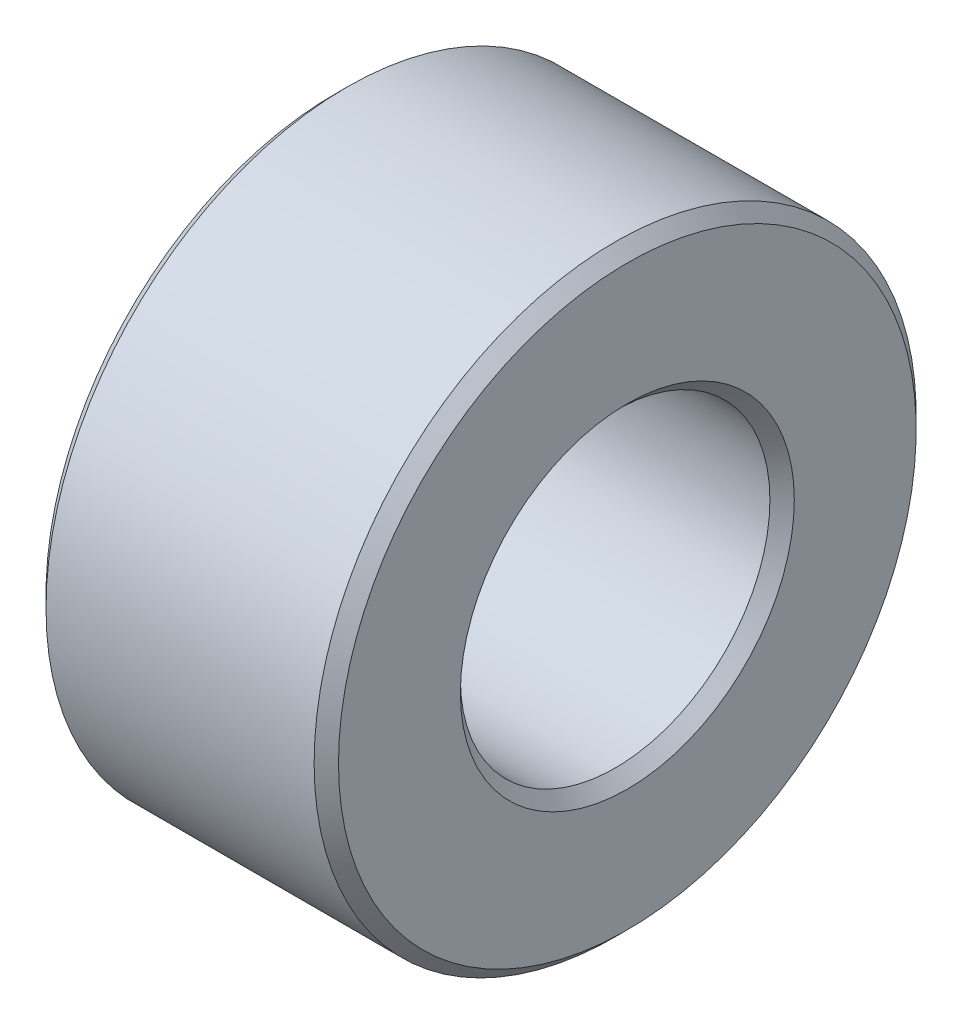
from build123d import *

# Parameters (mm, degrees)
SKETCH1_W     = 6
SKETCH1_H     = 3
CHAMFER1_SIZE = 0.25


with BuildPart() as part:
    # Sketch1 → Revolve1 (revolve)
    with BuildSketch(Plane.XY, mode=Mode.PRIVATE) as revolve1_sk:
        with Locations((0, 4.675)):
            Rectangle(SKETCH1_W, SKETCH1_H)
    revolve(revolve1_sk.sketch.rotate(Axis((0, 0, 0), (1, 0, 0)), 90), axis=Axis((0, 0, 0), (1, 0, 0)))

    # Chamfer1
    chamfer1_edges = [part.edges().sort_by_distance(p)[0] for p in [
        (-3, 0, -3.175),
        (3, 0, -3.175),
        (3, 0, -6.175),
        (-3, 0, -6.175),
    ]]
    chamfer(chamfer1_edges, length=CHAMFER1_SIZE)


solid = part.part
